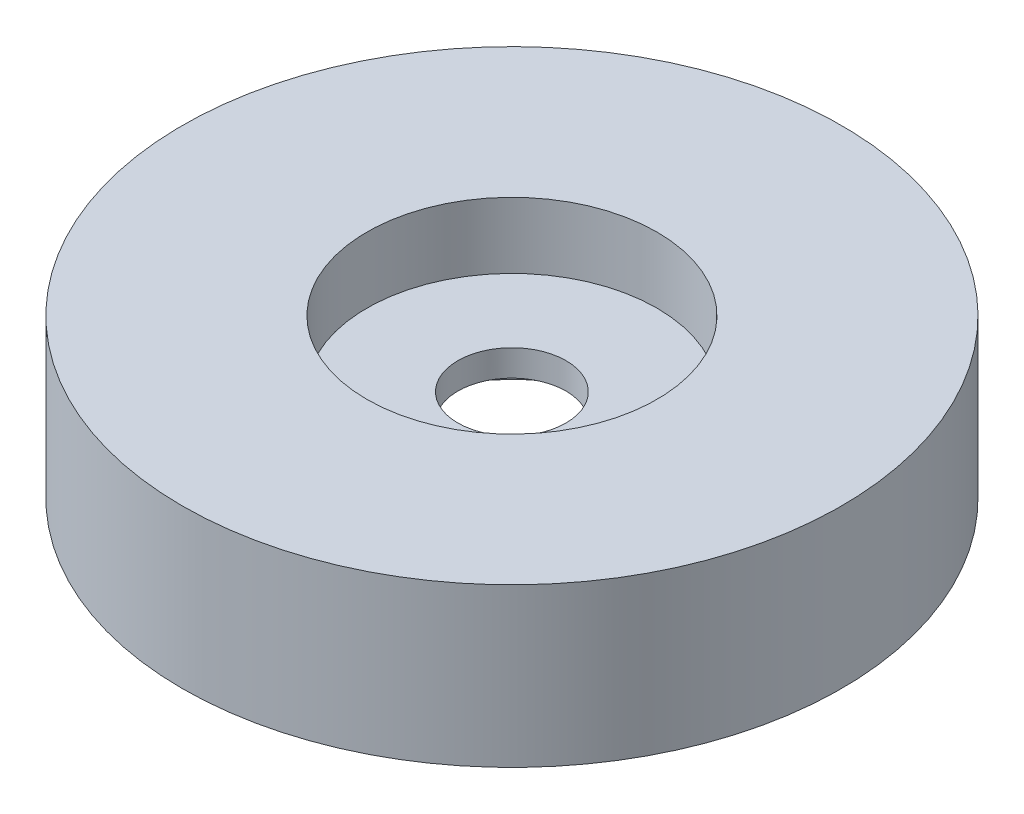
from build123d import *

# Parameters (mm, degrees)
SKETCH1_R           = 25
SKETCH1_R_2         = 4.1
BOSS_EXTRUDE1_DEPTH = 12
SKETCH2_R           = 11
CUT_EXTRUDE1_DEPTH  = 5
SKETCH3_R           = 11.05
CUT_EXTRUDE2_DEPTH  = 5


with BuildPart() as part:
    # Sketch1 → Boss-Extrude1 (new body)
    with BuildSketch(Plane(origin=(0, 0, 0), x_dir=(1, 0, 0), z_dir=(0, 1, 0))):
        with Locations(Location((0, 0, 0), (0, 0, 270))):
            Circle(SKETCH1_R)
        with Locations(Location((0, 0, 0), (0, 0, 270))):
            Circle(SKETCH1_R_2, mode=Mode.SUBTRACT)
    extrude(amount=BOSS_EXTRUDE1_DEPTH)

    # Sketch2 → Cut-Extrude1 (cut)
    with BuildSketch(Plane(origin=(0, 12, 0), x_dir=(1, 0, 0), z_dir=(0, 1, 0))):
        with Locations(Location((0, 0, 0), (0, 0, 270))):
            Circle(SKETCH2_R)
    extrude(amount=-CUT_EXTRUDE1_DEPTH, mode=Mode.SUBTRACT)

    # Sketch3 → Cut-Extrude2 (cut)
    with BuildSketch(Plane.XZ):
        with Locations(Location((0, 0, 0), (0, 0, 270))):
            Circle(SKETCH3_R)
    extrude(amount=-CUT_EXTRUDE2_DEPTH, mode=Mode.SUBTRACT)


solid = part.part
